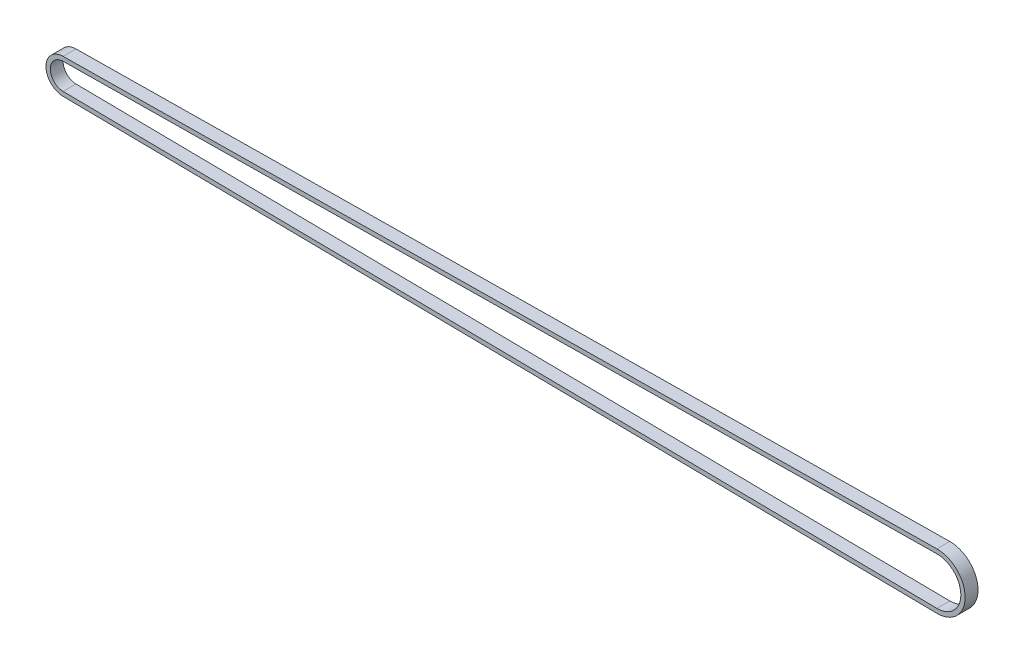
from build123d import *

# Parameters (mm, degrees)
EXTRUDE_THIN1_DEPTH = 3


with BuildPart() as part:
    # Sketch2 → Extrude-Thin1 (new, symmetric)
    with BuildSketch(Plane.XY):
        with BuildLine():
            Line((-0.095640045, 8.06943325), (406.868394403, 12.892827569))
            ThreePointArc((406.868394403, 12.892827569), (420.022460946, -0.109653301), (406.861607202, -13.105264257))
            Line((406.861607202, -13.105264257), (-0.09985333, -8.069382214))
            ThreePointArc((-0.09985333, -8.069382214), (-8.069999725, 0.002106797), (-0.095640045, 8.06943325))
        make_face()
        with BuildLine():
            Line((-0.071937431, 6.069573709), (406.892097016, 10.892968027))
            ThreePointArc((406.892097016, 10.892968027), (418.022461015, -0.10913117), (406.886354, -11.105417364))
            Line((406.886354, -11.105417364), (-0.075106532, -6.069535321))
            ThreePointArc((-0.075106532, -6.069535321), (-6.069999793, 0.001584666), (-0.071937431, 6.069573709))
        make_face(mode=Mode.SUBTRACT)
    extrude(amount=EXTRUDE_THIN1_DEPTH, both=True)


solid = part.part
